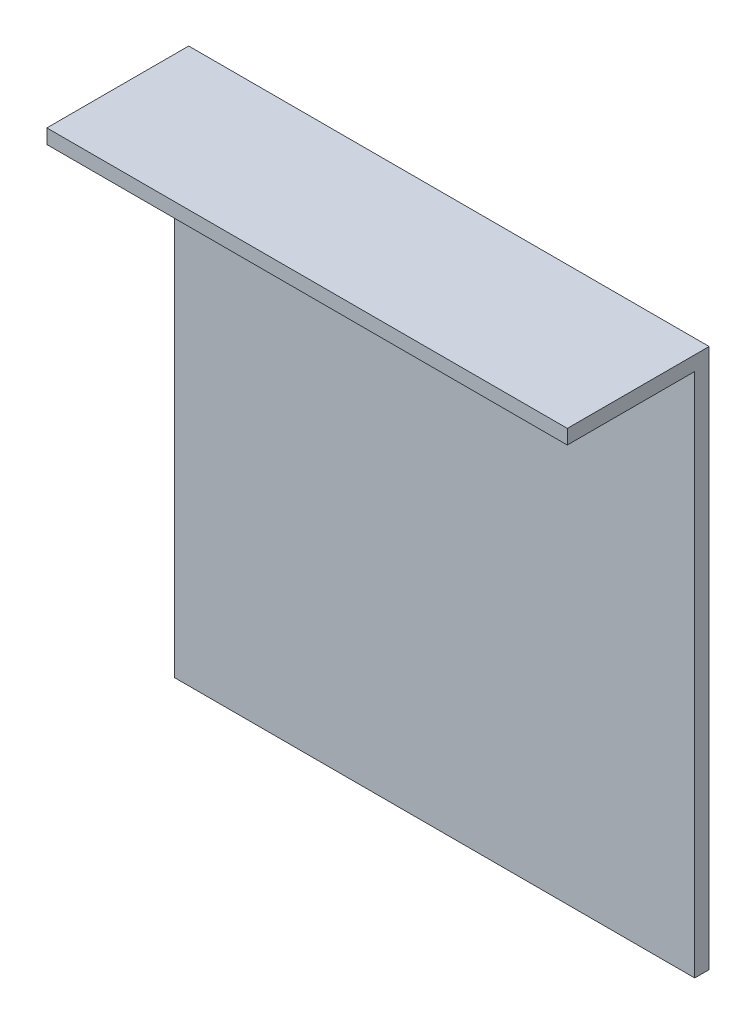
from build123d import *

# Parameters (mm, degrees)
SKETCH1_W           = 433
SKETCH1_H           = 449
BOSS_EXTRUDE1_DEPTH = 12
SKETCH4_W           = 433
SKETCH4_H           = 12
BOSS_EXTRUDE3_DEPTH = 106


with BuildPart() as part:
    # Sketch1 → Boss-Extrude1 (new body)
    with BuildSketch(Plane.XY):
        with Locations((0, -5.5)):
            Rectangle(SKETCH1_W, SKETCH1_H)
    extrude(amount=BOSS_EXTRUDE1_DEPTH)

    # Sketch4 → Boss-Extrude3 (add)
    with BuildSketch(Plane.XY.offset(12)):
        with Locations((0, 213)):
            Rectangle(SKETCH4_W, SKETCH4_H)
    extrude(amount=BOSS_EXTRUDE3_DEPTH)


solid = part.part
